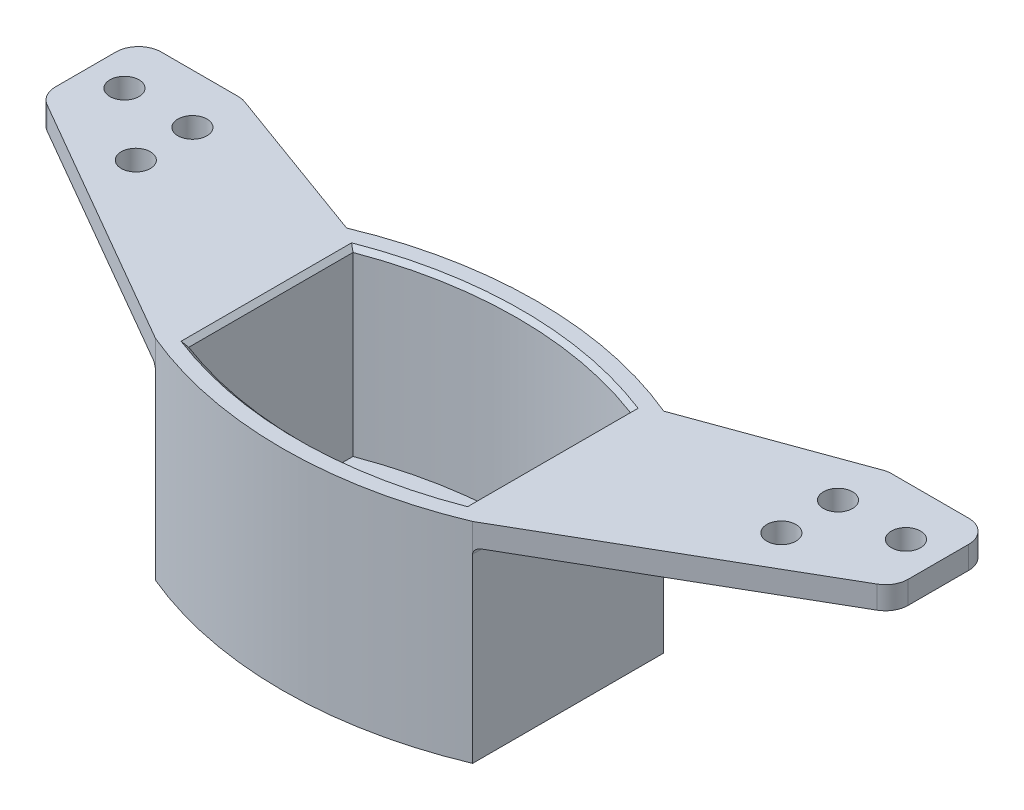
from build123d import *

# Parameters (mm, degrees)
SKETCH1_R            = 3.675
BOSS_EXTRUDE1_DEPTH  = 6.35
BOSS_EXTRUDE2_START  = 40.64
BOSS_EXTRUDE2_DEPTH  = 40.64
CHAMFER1_SIZE        = 1.016
SKETCH3_R            = 3.2639
BOSS_EXTRUDE3_DEPTH  = 5.08
FILLET1_R            = 5.08
FILLET1_OF_MIRROR1_R = 5.08
FILLET2_R            = 1.27


with BuildPart() as part:
    # Sketch1 → Boss-Extrude1 (new body)
    with BuildSketch(Plane(origin=(0, 0, 0), x_dir=(1, 0, 0), z_dir=(0, 1, 0))):
        with BuildLine():
            Line((-35.56, 21.431101635), (-35.56, -21.431101635))
            ThreePointArc((-35.56, -21.431101635), (0, -28.575), (35.56, -21.431101635))
            Line((35.56, -21.431101635), (35.56, 21.431101635))
            ThreePointArc((35.56, 21.431101635), (0, 28.575), (-35.56, 21.431101635))
        make_face()
        with Locations(Location((-22.86, 11.43, 0), (0, 0, 270))):
            Circle(SKETCH1_R, mode=Mode.SUBTRACT)
        with Locations(Location((0, 11.43, 0), (0, 0, 270))):
            Circle(SKETCH1_R, mode=Mode.SUBTRACT)
        with Locations(Location((22.86, 11.43, 0), (0, 0, 270))):
            Circle(SKETCH1_R, mode=Mode.SUBTRACT)
        with Locations(Location((0, -11.43, 0), (0, 0, 270))):
            Circle(SKETCH1_R, mode=Mode.SUBTRACT)
    extrude(amount=-BOSS_EXTRUDE1_DEPTH)

    # Sketch2 → Boss-Extrude2 (add)
    with BuildSketch(Plane(origin=(0, 0, 0), x_dir=(1, 0, 0), z_dir=(0, 1, 0)).offset(BOSS_EXTRUDE2_START)):
        with BuildLine():
            Line((-35.56, 21.431101635), (-35.56, -21.431101635))
            ThreePointArc((-35.56, -21.431101635), (0, -28.575), (35.56, -21.431101635))
            Line((35.56, -21.431101635), (35.56, 21.431101635))
            ThreePointArc((35.56, 21.431101635), (0, 28.575), (-35.56, 21.431101635))
        make_face()
        with BuildLine():
            Line((-31.115, 18.419922333), (-31.115, -18.419922333))
            ThreePointArc((-31.115, -18.419922333), (0, -24.13), (31.115, -18.419922333))
            Line((31.115, -18.419922333), (31.115, 18.419922333))
            ThreePointArc((31.115, 18.419922333), (0, 24.13), (-31.115, 18.419922333))
        make_face(mode=Mode.SUBTRACT)
    extrude(amount=-BOSS_EXTRUDE2_DEPTH)

    # Chamfer1
    chamfer1_edges = [part.edges().sort_by_distance(p)[0] for p in [
        (0, 40.64, -24.13),
        (-31.115, 40.64, 0),
        (0, 40.64, 24.13),
        (31.115, 40.64, 0),
    ]]
    chamfer(chamfer1_edges, length=CHAMFER1_SIZE)

    # Sketch3 → Boss-Extrude3 (add)
    with BuildSketch(Plane(origin=(0, 40.64, 0), x_dir=(1, 0, 0), z_dir=(0, 1, 0))):
        Polygon((-35.56, -21.431101635), (-95.622719028, 13.246125363), (-95.622719028, 34.836125363), (-72.39, 34.836125363), (-35.56, 21.431101635), align=None)
        with Locations(Location((-87.63, 23.684417071, 0), (0, 0, 270))):
            Circle(SKETCH3_R, mode=Mode.SUBTRACT)
        with Locations(Location((-72.39, 23.684417071, 0), (0, 0, 270))):
            Circle(SKETCH3_R, mode=Mode.SUBTRACT)
        with Locations(Location((-72.39, 10.984417071, 0), (0, 0, 270))):
            Circle(SKETCH3_R, mode=Mode.SUBTRACT)
    boss_extrude3 = extrude(amount=-BOSS_EXTRUDE3_DEPTH)

    # Fillet1
    fillet1_edges = [part.edges().sort_by_distance(p)[0] for p in [
        (-95.622719028, 38.1, -13.246125363),
        (-95.622719028, 38.1, -34.836125363),
        (-72.39, 38.1, -34.836125363),
    ]]
    fillet(fillet1_edges, radius=FILLET1_R)

    # Mirror1: Boss-Extrude3 across plane
    add(boss_extrude3.mirror(Plane(origin=(0, 0, 0), x_dir=(0, 0, 1), z_dir=(1, 0, 0))))

    # Fillet1 of Mirror1
    fillet1_of_mirror1_edges = [part.edges().sort_by_distance(p)[0] for p in [
        (95.622719028, 38.1, -13.246125363),
        (95.622719028, 38.1, -34.836125363),
        (72.39, 38.1, -34.836125363),
    ]]
    fillet(fillet1_of_mirror1_edges, radius=FILLET1_OF_MIRROR1_R)

    # Fillet2
    fillet2_edges = [part.edges().sort_by_distance(p)[0] for p in [
        (35.56, 35.56, 0),
        (-35.56, 35.56, 0),
    ]]
    fillet(fillet2_edges, radius=FILLET2_R)


solid = part.part
